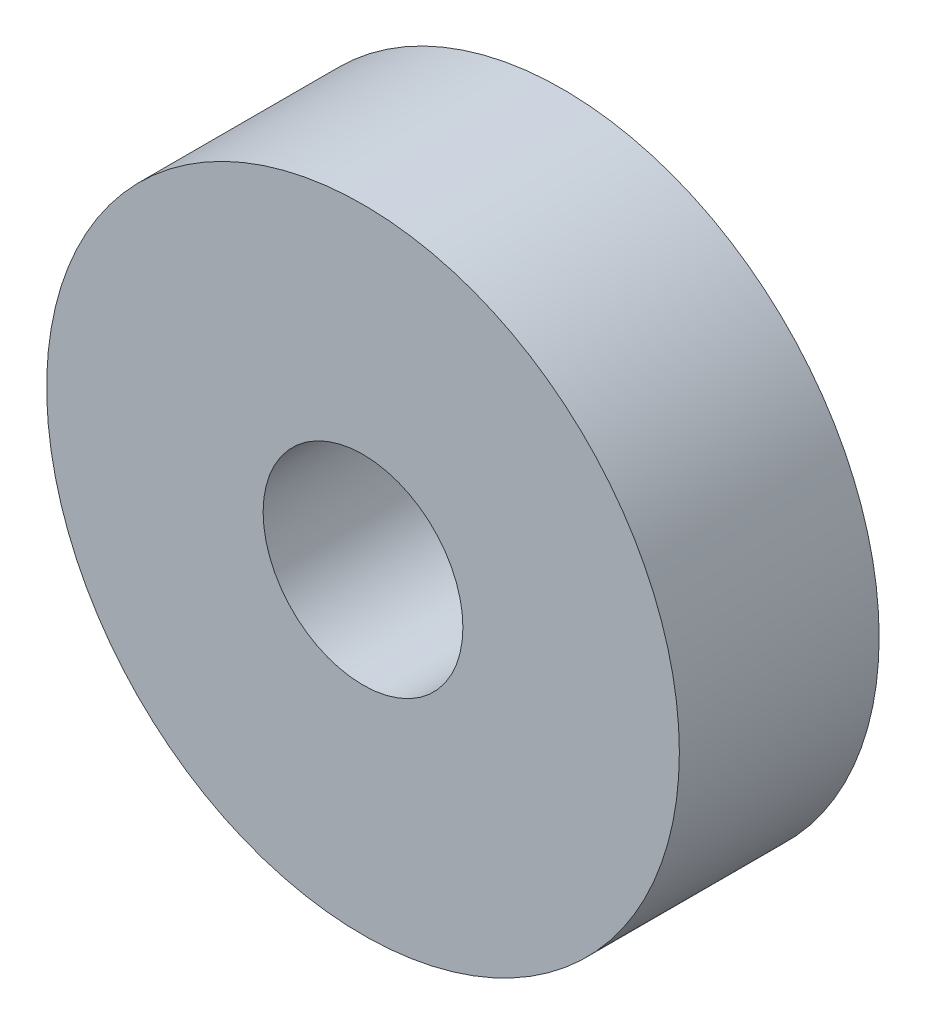
from build123d import *

# Parameters (mm, degrees)
ESQUISSE1_R             = 9.5
BOSS_EXTRU_1_DEPTH      = 6
ESQUISSE2_R             = 3
ENL_V_MAT_EXTRU_1_DEPTH = 6


with BuildPart() as part:
    # Esquisse1 → Boss.-Extru.1 (new body)
    with BuildSketch(Plane.XY):
        Circle(ESQUISSE1_R)
    extrude(amount=BOSS_EXTRU_1_DEPTH)

    # Esquisse2 → Enlèv. mat.-Extru.1 (cut)
    with BuildSketch(Plane.XY.offset(6)):
        Circle(ESQUISSE2_R)
    extrude(amount=-ENL_V_MAT_EXTRU_1_DEPTH, mode=Mode.SUBTRACT)


solid = part.part
